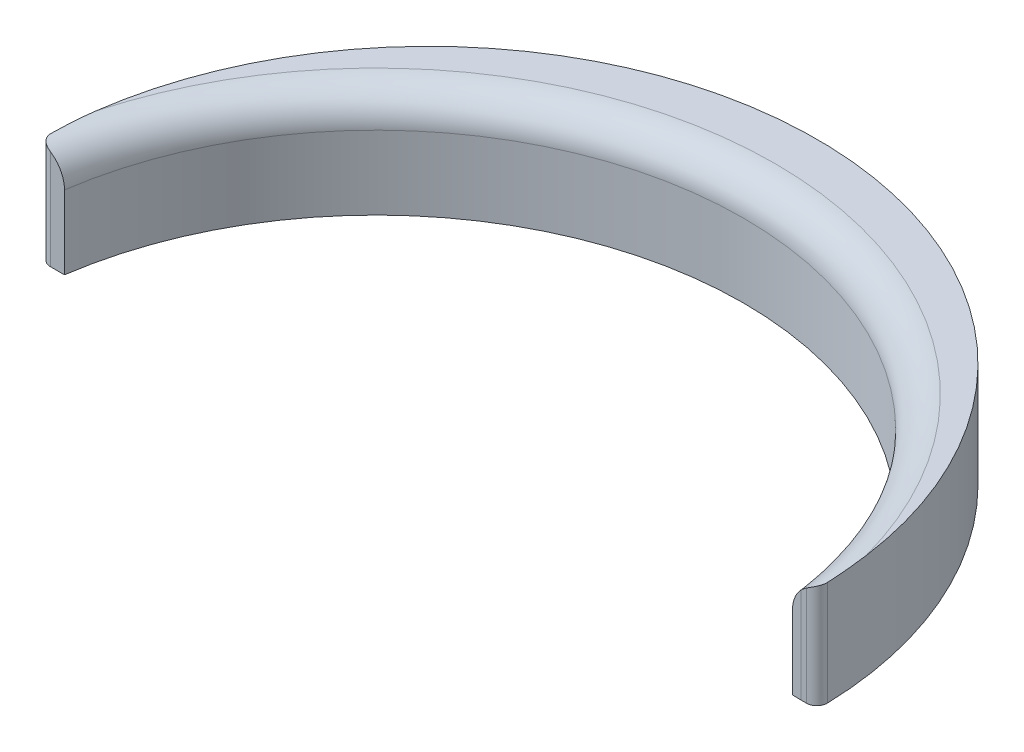
from build123d import *

# Parameters (mm, degrees)
EXTRUDE_1_DEPTH     = 10
FILLET_2_R          = 3
SKETCH_2_R          = 1.5
CUT_EXTRUDE_1_DEPTH = 7


with BuildPart() as part:
    # 草图1 → 凸台-拉伸1 (new body)
    with BuildSketch(Plane(origin=(0, 0, 0), x_dir=(1, 0, 0), z_dir=(0, 1, 0))):
        with BuildLine():
            Line((35.177708011, -0.253238784), (35.667337743, -0.253238784))
            ThreePointArc((35.667337743, -0.253238784), (36.384198182, 0.049544528), (36.666951866, 0.774538994))
            ThreePointArc((36.666951866, 0.774538994), (-0.318770688, 36.746761216), (-37.304493242, 0.774538994))
            ThreePointArc((-37.304493242, 0.774538994), (-37.021739558, 0.049544528), (-36.304879119, -0.253238784))
            Line((-36.304879119, -0.253238784), (-35.815249387, -0.253238784))
            Line((-35.815249387, -0.253238784), (-34.959786839, -0.253238784))
            ThreePointArc((-34.959786839, -0.253238784), (-0.330707465, 29.746759181), (34.318826897, -0.229611257))
            Line((34.318826897, -0.229611257), (35.177708011, -0.253238784))
        make_face()
    extrude(amount=EXTRUDE_1_DEPTH)

    # 圆角2
    fillet_2_edges = [part.edges().sort_by_distance(p)[0] for p in [
        (-0.330707465, 10, -29.746759181),
    ]]
    fillet(fillet_2_edges, radius=FILLET_2_R)

    # 草图2 → 切除-拉伸1 (cut)
    with BuildSketch(Plane.XZ):
        with Locations(Location((-15.318770688, -29.700892818, 0), (0, 0, 270))):
            Circle(SKETCH_2_R)
        with Locations(Location((14.681229312, -29.700892818, 0), (0, 0, 90))):
            Circle(SKETCH_2_R)
    extrude(amount=-CUT_EXTRUDE_1_DEPTH, mode=Mode.SUBTRACT)


solid = part.part
